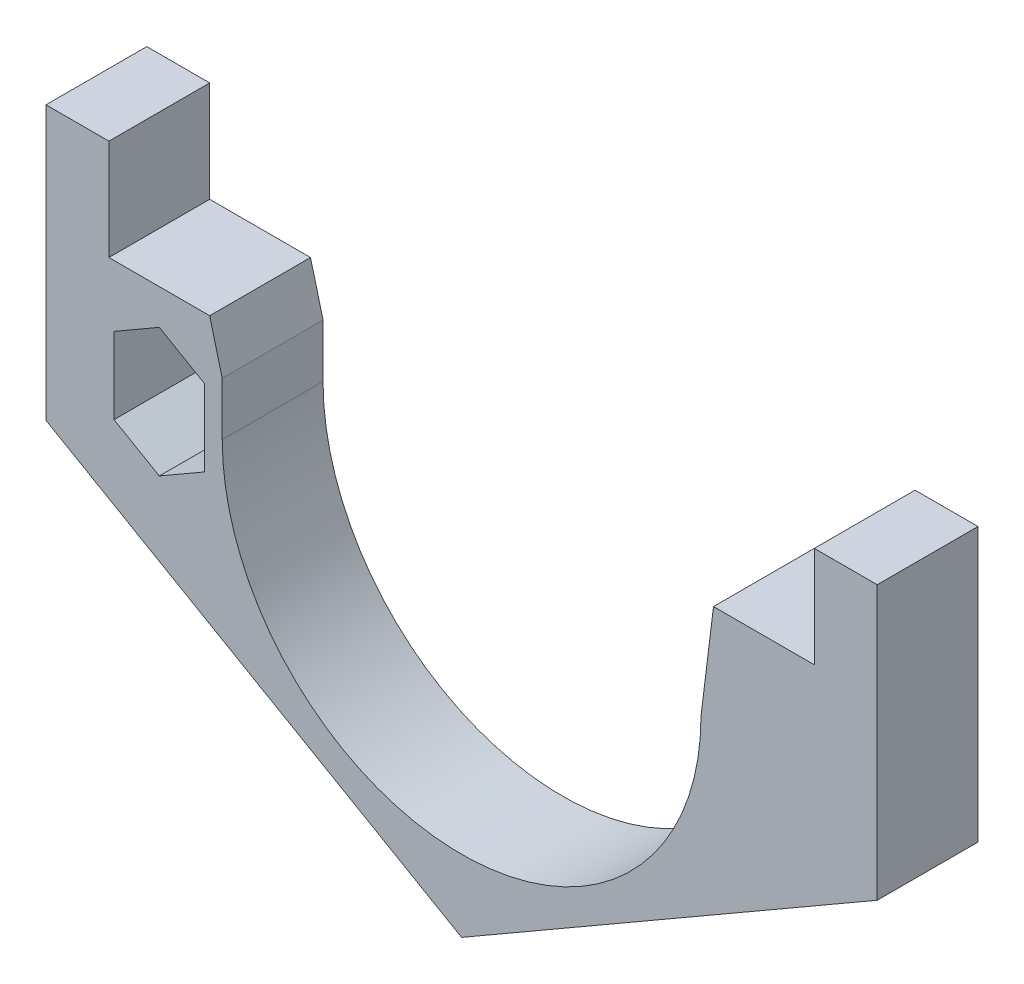
from build123d import *

# Parameters (mm, degrees)
AUFSATZ_LINEAR_AUSTRAGEN1_DEPTH = 20


with BuildPart() as part:
    # Skizze1 → Aufsatz-Linear austragen1 (new body)
    with BuildSketch(Plane.XY):
        with BuildLine():
            Line((-49.984452808, 20.068980322), (-69.984452808, 20.068980322))
            Line((-69.984452808, 20.068980322), (-69.984452808, 40.068980322))
            Line((-69.984452808, 40.068980322), (-82.468350795, 40.068980322))
            Line((-82.468350795, 40.068980322), (-82.468350795, -2.937308237))
            Line((-82.468350795, -2.937308237), (-82.468350795, -14.163354272))
            Line((-82.468350795, -14.163354272), (0, -61.776478803))
            Line((0, -61.776478803), (82.468350795, -14.163354272))
            Line((82.468350795, -14.163354272), (82.468350795, -2.937308237))
            Line((82.468350795, -2.937308237), (82.468350795, 40.068980322))
            Line((82.468350795, 40.068980322), (69.984452808, 40.068980322))
            Line((69.984452808, 40.068980322), (69.984452808, 20.068980322))
            Line((69.984452808, 20.068980322), (49.984452808, 20.068980322))
            Line((49.984452808, 20.068980322), (47.5, 0))
            ThreePointArc((47.5, 0), (0, -47.5), (-47.5, 0))
            Line((-47.5, 0), (-47.5, 10.568980322))
            Line((-47.5, 10.568980322), (-49.984452808, 20.068980322))
        make_face()
        Polygon((-59.984452808, 13.068980322), (-51, 7.881804075), (-51, -7.286243364), (-59.984452808, -12.47341961), (-68.968905615, -7.286243364), (-68.968905615, 7.881804075), align=None, mode=Mode.SUBTRACT)
    extrude(amount=AUFSATZ_LINEAR_AUSTRAGEN1_DEPTH)


solid = part.part
